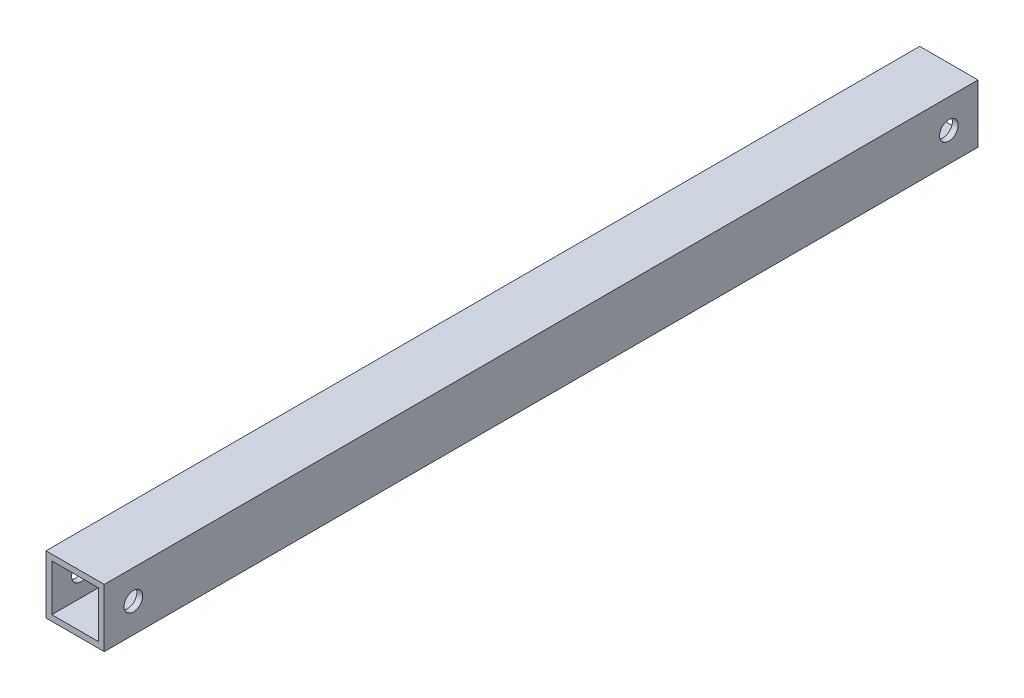
from build123d import *

# Parameters (mm, degrees)
SKETCH_1_W          = 10
SKETCH_1_H          = 10
SKETCH_1_W_2        = 8
SKETCH_1_H_2        = 8
EXTRUDE_1_DEPTH     = 150
SKETCH_2_R          = 1.6
CUT_EXTRUDE_1_DEPTH = 151.416089565


with BuildPart() as part:
    # ｽｹｯﾁ1 → ﾎﾞｽ - 押し出し1 (new body)
    with BuildSketch(Plane.XY):
        Rectangle(SKETCH_1_W, SKETCH_1_H)
        Rectangle(SKETCH_1_W_2, SKETCH_1_H_2, mode=Mode.SUBTRACT)
    extrude(amount=EXTRUDE_1_DEPTH)

    # ｽｹｯﾁ2 → ｶｯﾄ - 押し出し1 (cut, through all)
    with BuildSketch(Plane(origin=(5, 0, 0), x_dir=(0, 0, -1), z_dir=(1, 0, 0))):
        with Locations(Location((-145, 0, 0), (0, 0, 90))):
            Circle(SKETCH_2_R)
        with Locations(Location((-5, 0, 0), (0, 0, 90))):
            Circle(SKETCH_2_R)
    extrude(amount=-CUT_EXTRUDE_1_DEPTH, mode=Mode.SUBTRACT)


solid = part.part
